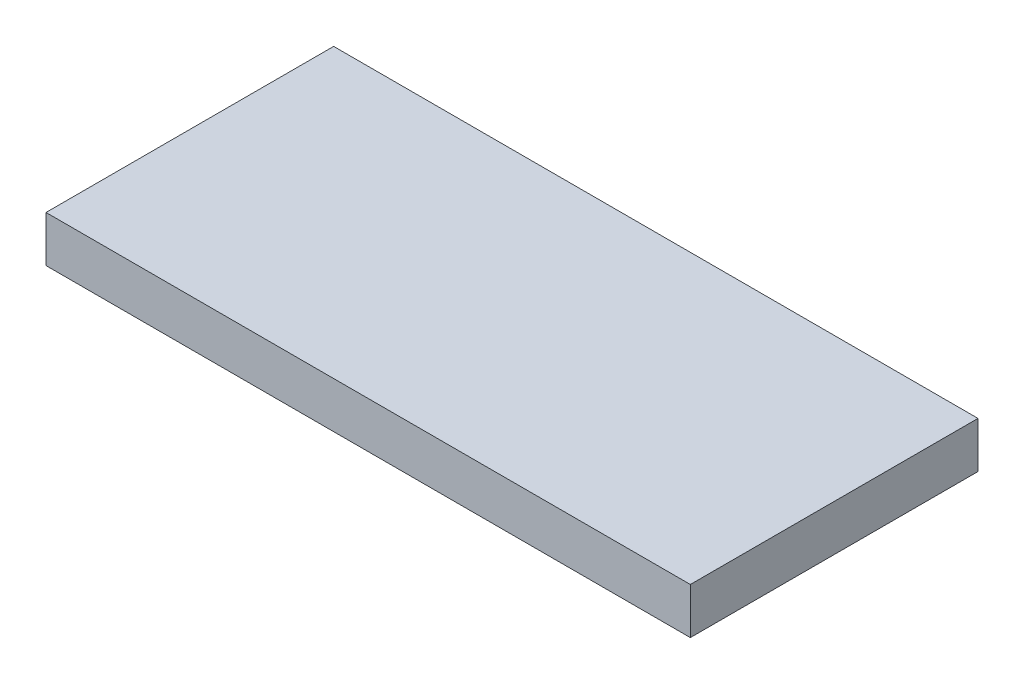
from build123d import *

# Parameters (mm, degrees)
SKETCH_1_W             = 56
SKETCH_1_H             = 4
TOP_MOUNT_BRIDGE_DEPTH = 25


with BuildPart() as part:
    # 草图1 → Top_mount_bridge (new body)
    with BuildSketch(Plane.XY):
        with Locations((28, 2)):
            Rectangle(SKETCH_1_W, SKETCH_1_H)
    extrude(amount=TOP_MOUNT_BRIDGE_DEPTH)


solid = part.part
